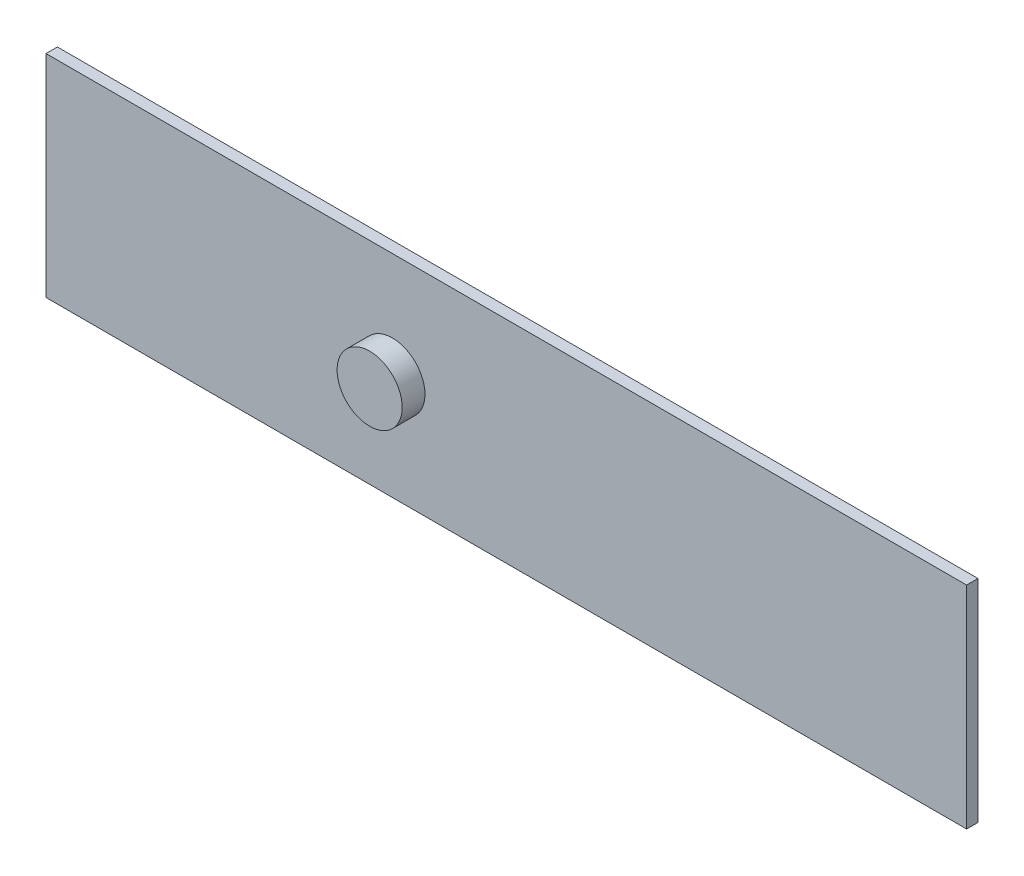
from build123d import *

# Parameters (mm, degrees)
SKETCH1_W           = 565.88
SKETCH1_H           = 129.88
BOSS_EXTRUDE1_DEPTH = 3.5
SKETCH2_R           = 20
BOSS_EXTRUDE2_DEPTH = 14


with BuildPart() as part:
    # Sketch1 → Boss-Extrude1 (new, symmetric)
    with BuildSketch(Plane.XY):
        Rectangle(SKETCH1_W, SKETCH1_H)
    extrude(amount=BOSS_EXTRUDE1_DEPTH, both=True)

    # Sketch2 → Boss-Extrude2 (add)
    with BuildSketch(Plane.XY.offset(3.5)):
        with Locations((-70, 0)):
            Circle(SKETCH2_R)
    extrude(amount=BOSS_EXTRUDE2_DEPTH)


solid = part.part
